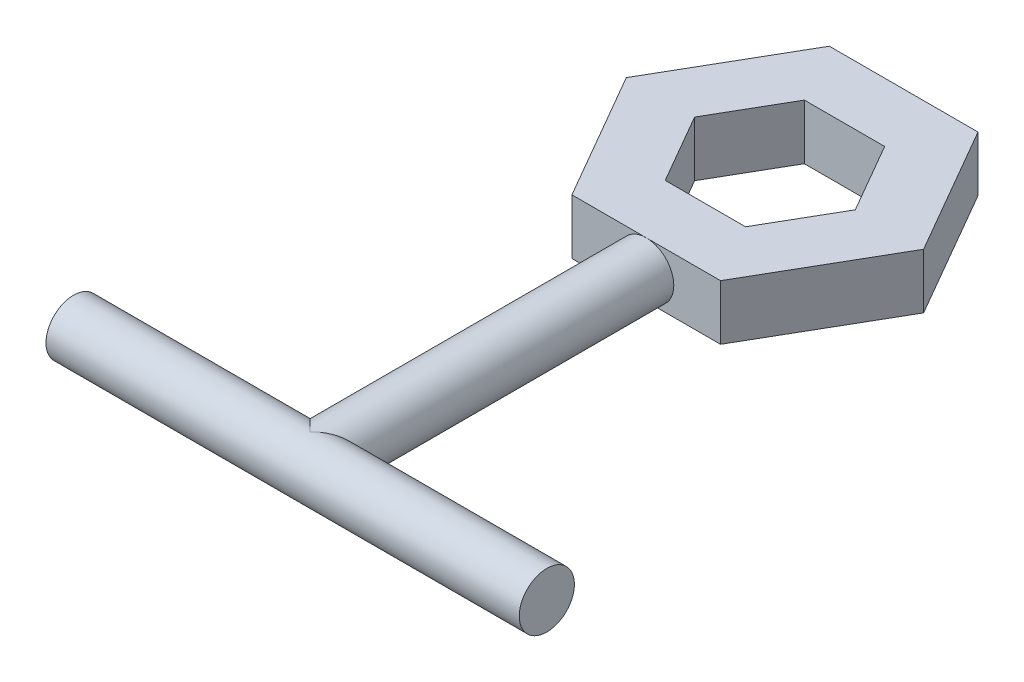
from build123d import *

# Parameters (mm, degrees)
BOSS_EXTRUDE1_DEPTH = 2.9591
SWEEP1_PROFILE_R    = 2.9591
SWEEP2_PROFILE_R    = 2.9591


with BuildPart() as part:
    # Sketch1 → Boss-Extrude1 (new, symmetric)
    with BuildSketch(Plane(origin=(0, 0, 0), x_dir=(1, 0, 0), z_dir=(0, 1, 0))):
        Polygon((7.97759508, 13.8176), (-7.97759508, 13.8176), (-15.955190159, 0), (-7.97759508, -13.8176), (7.97759508, -13.8176), (15.955190159, 0), align=None)
        Polygon((8.62284174, 0), (4.31142087, 7.4676), (-4.31142087, 7.4676), (-8.62284174, 0), (-4.31142087, -7.4676), (4.31142087, -7.4676), align=None, mode=Mode.SUBTRACT)
    extrude(amount=BOSS_EXTRUDE1_DEPTH, both=True)

    # Sweep1: sweep along a path in Sketch6
    with BuildLine(Plane(origin=(0, 0, 0), x_dir=(1, 0, 0), z_dir=(0, 1, 0))) as sweep1_path:
        Line((0, -13.8176), (0, -49.8856))
    # Sweep1 profile (on start of the path) → Sweep1 (sweep)
    with BuildSketch(Plane.XY.offset(13.8176)):
        Circle(SWEEP1_PROFILE_R)
    sweep(path=sweep1_path.line)

    # Sweep2: sweep along a path in Sketch6<4>
    with BuildLine(Plane(origin=(0, 0, 0), x_dir=(1, 0, 0), z_dir=(0, 1, 0))) as sweep2_path:
        Line((25.4, -49.8856), (-25.4, -49.8856))
    # Sweep2 profile (on start of the path) → Sweep2 (sweep)
    with BuildSketch(Plane(origin=(25.4, 0, 49.8856), x_dir=(0, 0, -1), z_dir=(-1, 0, 0))):
        Circle(SWEEP2_PROFILE_R)
    sweep(path=sweep2_path.line)


solid = part.part
